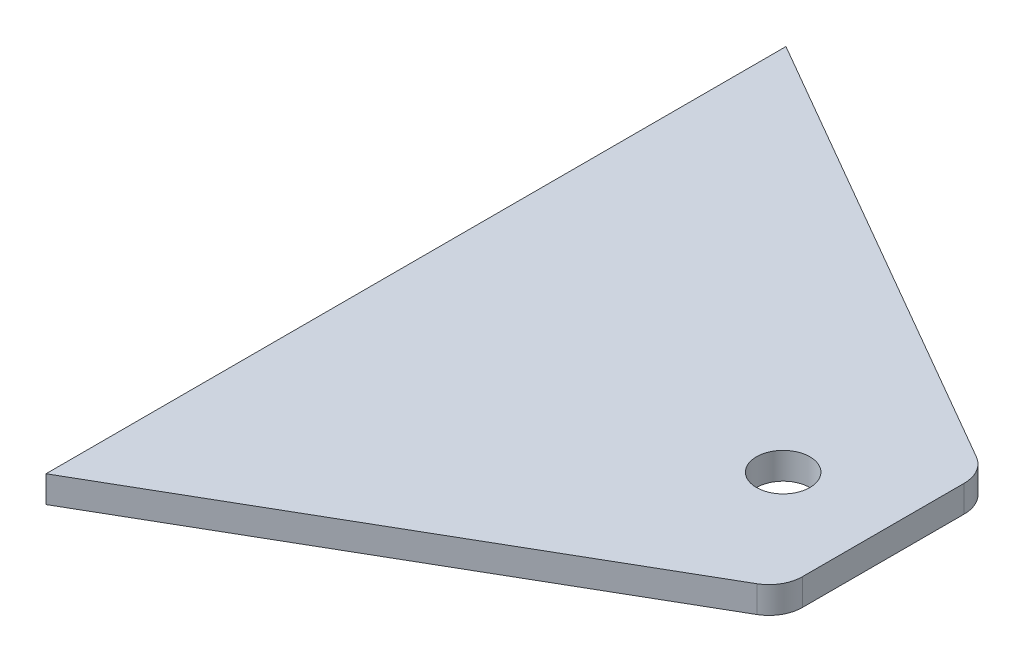
from build123d import *

# Parameters (mm, degrees)
BOSS_EXTRUDE1_DEPTH = 4
SKETCH3_R           = 4
CUT_EXTRUDE1_DEPTH  = 105.985426706
FILLET1_R           = 5


with BuildPart() as part:
    # Sketch2 → Boss-Extrude1 (new body)
    with BuildSketch(Plane(origin=(0, 0, 0), x_dir=(1, 0, 0), z_dir=(0, 1, 0))):
        Polygon((70, -37.725994468), (70, -7.725994468), (0, 32.688524375), (0, -78.140513312), align=None)
    extrude(amount=BOSS_EXTRUDE1_DEPTH)

    # Sketch3 → Cut-Extrude1 (cut, through all)
    with BuildSketch(Plane(origin=(0, 4, 0), x_dir=(1, 0, 0), z_dir=(0, 1, 0))):
        with Locations(Location((55, -22.725994468, 0), (0, 0, 270))):
            Circle(SKETCH3_R)
    extrude(amount=-CUT_EXTRUDE1_DEPTH, mode=Mode.SUBTRACT)

    # Fillet1
    fillet1_edges = [part.edges().sort_by_distance(p)[0] for p in [
        (70, 2, 7.725994468),
        (70, 2, 37.725994468),
    ]]
    fillet(fillet1_edges, radius=FILLET1_R)


solid = part.part
